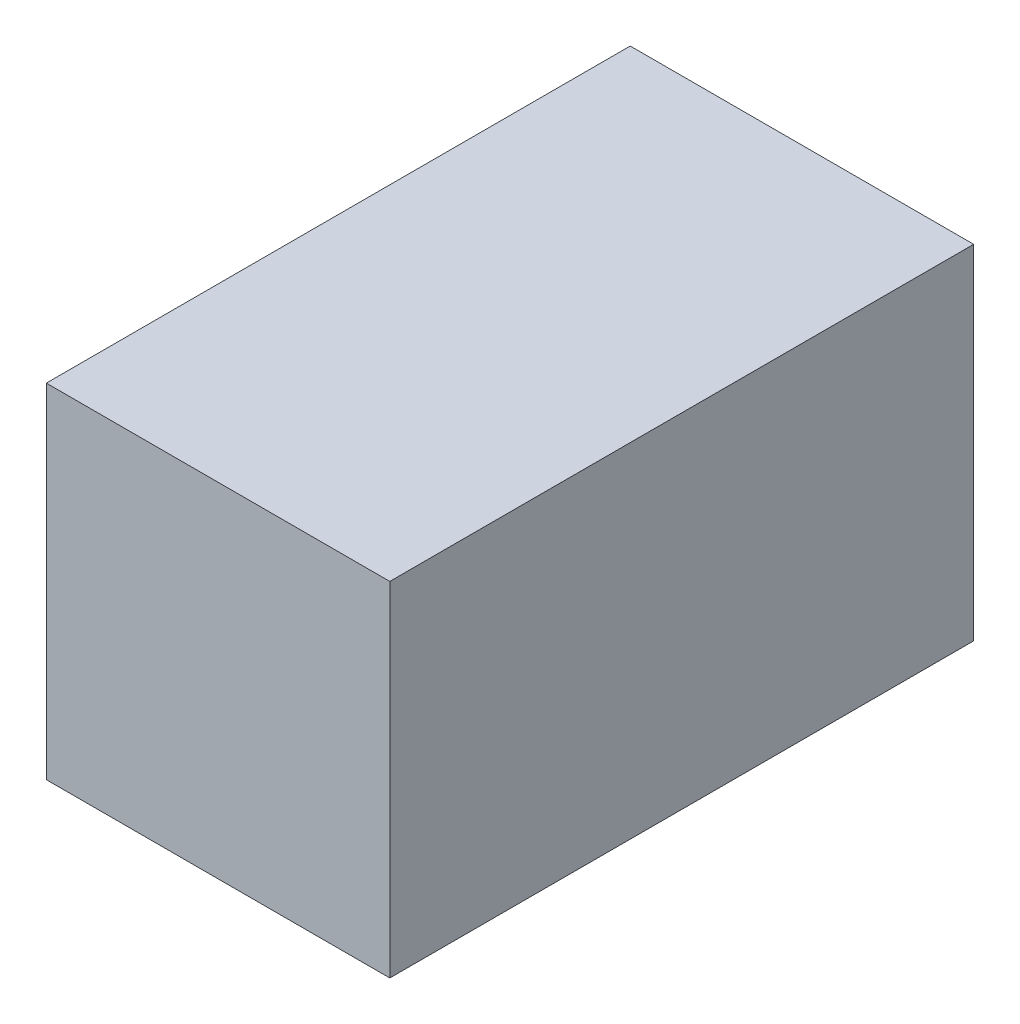
from build123d import *

# Parameters (mm, degrees)
EXTRUDE_1_DEPTH      = 10
EXTRUDE_1_DEPTH_BACK = 7
SKETCH_1_W           = 10
SKETCH_1_H           = 10


with BuildPart() as part:
    # 草图1 → 凸台-拉伸1 (new, two sides: drawn at the far end of the back side and taken through both)
    with BuildSketch(Plane.XY.offset(-EXTRUDE_1_DEPTH_BACK)):
        with Locations((5, 5)):
            Rectangle(SKETCH_1_W, SKETCH_1_H)
    extrude(amount=EXTRUDE_1_DEPTH + EXTRUDE_1_DEPTH_BACK)


solid = part.part
